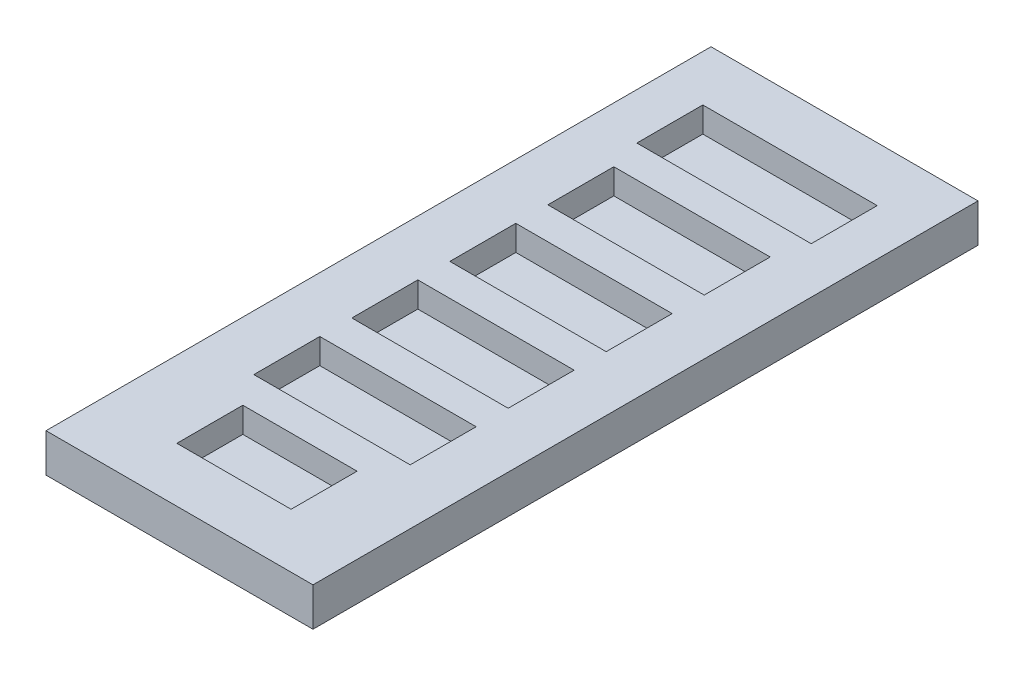
from build123d import *

# Parameters (mm, degrees)
SKETCH_1_W          = 444
SKETCH_1_H          = 1106
EXTRUDE_305_DEPTH   = 64
CUT_EXTRUDE_1_DEPTH = 42


with BuildPart() as part:
    # Эскиз1 → Extrude 305 (new body)
    with BuildSketch(Plane(origin=(0, 0, 0), x_dir=(1, 0, 0), z_dir=(0, 1, 0))):
        with Locations((222, 553)):
            Rectangle(SKETCH_1_W, SKETCH_1_H)
    extrude(amount=-EXTRUDE_305_DEPTH)

    # Эскиз2 → Вырез-Вытянуть1 (cut)
    with BuildSketch(Plane(origin=(0, 0, 0), x_dir=(1, 0, 0), z_dir=(0, 1, 0))):
        Polygon((222, 1015.363466897), (77, 1015.363466897), (77, 905.636533103), (222, 905.636533103), (367, 905.636533103), (367, 1015.363466897), align=None)
        Polygon((222, 852.363466897), (92, 852.363466897), (92, 742.636533103), (222, 742.636533103), (352, 742.636533103), (352, 852.363466897), align=None)
        Polygon((222, 689.363466897), (92, 689.363466897), (92, 579.636533103), (222, 579.636533103), (352, 579.636533103), (352, 689.363466897), align=None)
        Polygon((222, 526.363466897), (92, 526.363466897), (92, 416.636533103), (222, 416.636533103), (352, 416.636533103), (352, 526.363466897), align=None)
        Polygon((222, 363.363466897), (92, 363.363466897), (92, 253.636533103), (222, 253.636533103), (352, 253.636533103), (352, 363.363466897), align=None)
        Polygon((222, 200.363466897), (127, 200.363466897), (127, 90.636533103), (222, 90.636533103), (317, 90.636533103), (317, 200.363466897), align=None)
    extrude(amount=-CUT_EXTRUDE_1_DEPTH, mode=Mode.SUBTRACT)


solid = part.part
